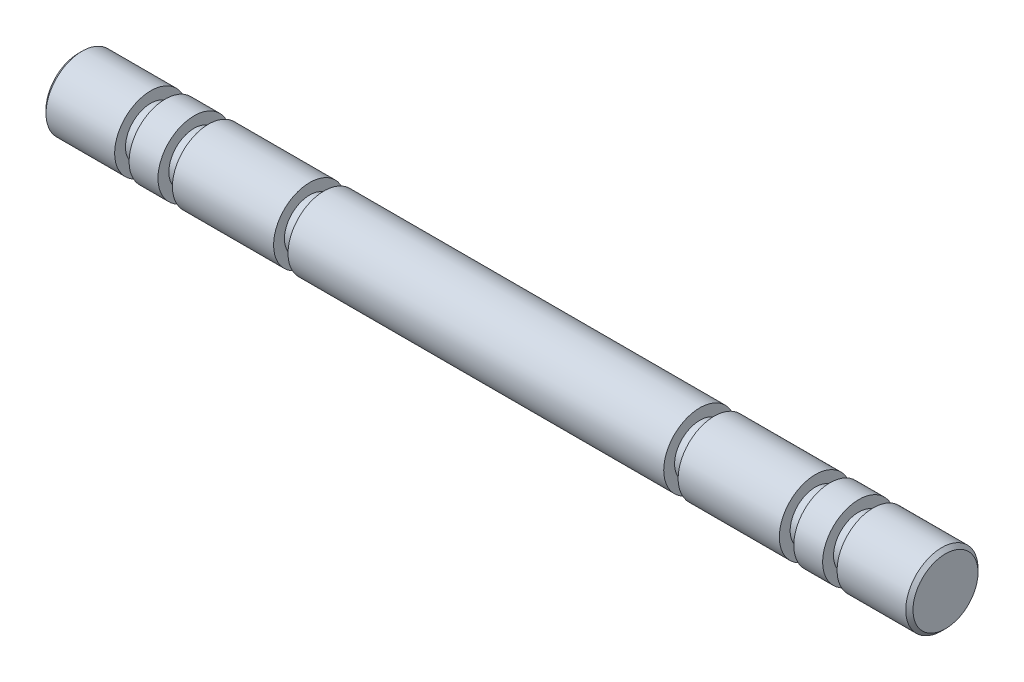
from build123d import *

# Parameters (mm, degrees)
SKETCH_1_R       = 5
EXTRUDE_1_DEPTH  = 52
SKETCH_2_R       = 3.5
EXTRUDE_2_DEPTH  = 2
SKETCH_3_R       = 5
EXTRUDE_3_DEPTH  = 14
SKETCH_4_R       = 3.5
EXTRUDE_4_DEPTH  = 2
SKETCH_5_R       = 5
EXTRUDE_5_DEPTH  = 4
SKETCH_6_R       = 3.5
EXTRUDE_6_DEPTH  = 2
SKETCH_7_R       = 5
EXTRUDE_7_DEPTH  = 10
EXTRUDE_START    = 2
SKETCH_8_R       = 3.5
EXTRUDE_8_DEPTH  = 2
EXTRUDE_START_2  = 14
SKETCH_9_R       = 5
EXTRUDE_9_DEPTH  = 14
SKETCH_10_R      = 3.5
EXTRUDE_10_DEPTH = 2
EXTRUDE_START_3  = 4
SKETCH_11_R      = 5
EXTRUDE_11_DEPTH = 4
SKETCH_12_R      = 3.5
EXTRUDE_12_DEPTH = 2
EXTRUDE_START_4  = 10
SKETCH_13_R      = 5
EXTRUDE_13_DEPTH = 10
CHAMFER_1_SIZE   = 0.5


with BuildPart() as part:
    # 草图1 → 凸台-拉伸1 (new body)
    with BuildSketch(Plane(origin=(0, 0, 0), x_dir=(0, 0, -1), z_dir=(1, 0, 0))):
        with Locations(Location((0, 0, 0), (0, 0, 180))):
            Circle(SKETCH_1_R)
    extrude(amount=EXTRUDE_1_DEPTH)

    # 草图2 → 凸台-拉伸2 (add)
    with BuildSketch(Plane(origin=(52, 0, 0), x_dir=(0, 0, -1), z_dir=(1, 0, 0))):
        Circle(SKETCH_2_R)
    extrude(amount=EXTRUDE_2_DEPTH)

    # 草图3 → 凸台-拉伸3 (add)
    with BuildSketch(Plane(origin=(54, 0, 0), x_dir=(0, 0, -1), z_dir=(1, 0, 0))):
        with Locations(Location((0, 0, 0), (0, 0, 180))):
            Circle(SKETCH_3_R)
    extrude(amount=EXTRUDE_3_DEPTH)

    # 草图4 → 凸台-拉伸4 (add)
    with BuildSketch(Plane(origin=(68, 0, 0), x_dir=(0, 0, -1), z_dir=(1, 0, 0))):
        Circle(SKETCH_4_R)
    extrude(amount=EXTRUDE_4_DEPTH)

    # 草图5 → 凸台-拉伸5 (add)
    with BuildSketch(Plane(origin=(70, 0, 0), x_dir=(0, 0, -1), z_dir=(1, 0, 0))):
        with Locations(Location((0, 0, 0), (0, 0, 180))):
            Circle(SKETCH_5_R)
    extrude(amount=EXTRUDE_5_DEPTH)

    # 草图6 → 凸台-拉伸6 (add)
    with BuildSketch(Plane(origin=(74, 0, 0), x_dir=(0, 0, -1), z_dir=(1, 0, 0))):
        Circle(SKETCH_6_R)
    extrude(amount=EXTRUDE_6_DEPTH)

    # 草图7 → 凸台-拉伸7 (add)
    with BuildSketch(Plane(origin=(76, 0, 0), x_dir=(0, 0, -1), z_dir=(1, 0, 0))):
        with Locations(Location((0, 0, 0), (0, 0, 180))):
            Circle(SKETCH_7_R)
    extrude(amount=EXTRUDE_7_DEPTH)

    # 草图8 → 凸台-拉伸8 (add)
    with BuildSketch(Plane.ZY.offset(EXTRUDE_START)):
        with Locations(Location((0, 0, 0), (0, 0, 180))):
            Circle(SKETCH_8_R)
    extrude(amount=-EXTRUDE_8_DEPTH)

    # 草图9 → 凸台-拉伸9 (add)
    with BuildSketch(Plane.ZY.offset(2).offset(EXTRUDE_START_2)):
        Circle(SKETCH_9_R)
    extrude(amount=-EXTRUDE_9_DEPTH)

    # 草图10 → 凸台-拉伸10 (add)
    with BuildSketch(Plane.ZY.offset(16).offset(EXTRUDE_START)):
        with Locations(Location((0, 0, 0), (0, 0, 180))):
            Circle(SKETCH_10_R)
    extrude(amount=-EXTRUDE_10_DEPTH)

    # 草图11 → 凸台-拉伸11 (add)
    with BuildSketch(Plane.ZY.offset(18).offset(EXTRUDE_START_3)):
        Circle(SKETCH_11_R)
    extrude(amount=-EXTRUDE_11_DEPTH)

    # 草图12 → 凸台-拉伸12 (add)
    with BuildSketch(Plane.ZY.offset(22).offset(EXTRUDE_START)):
        with Locations(Location((0, 0, 0), (0, 0, 180))):
            Circle(SKETCH_12_R)
    extrude(amount=-EXTRUDE_12_DEPTH)

    # 草图13 → 凸台-拉伸13 (add)
    with BuildSketch(Plane.ZY.offset(24).offset(EXTRUDE_START_4)):
        Circle(SKETCH_13_R)
    extrude(amount=-EXTRUDE_13_DEPTH)

    # 倒角1
    chamfer_1_edges = [part.edges().sort_by_distance(p)[0] for p in [
        (86, 0, -5),
        (-34, 0, -5),
    ]]
    chamfer(chamfer_1_edges, length=CHAMFER_1_SIZE)


solid = part.part
